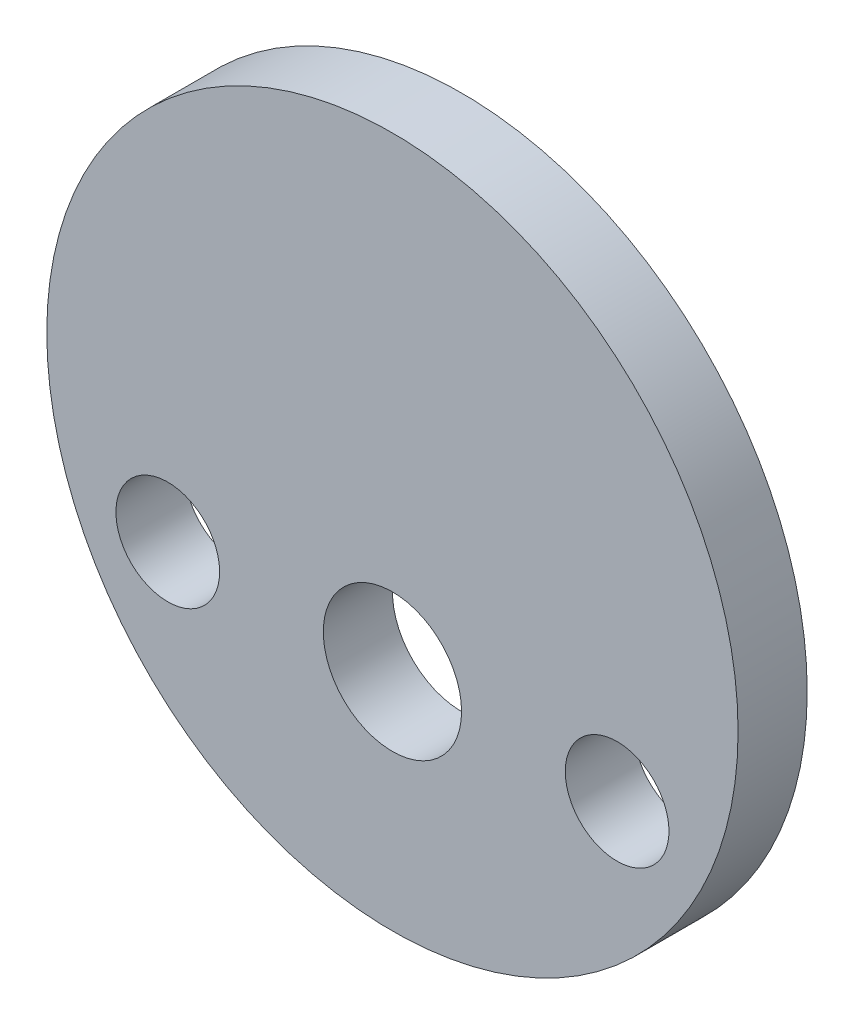
from build123d import *

# Parameters (mm, degrees)
SKETCH_1_R      = 10
SKETCH_1_R_2    = 1.5
SKETCH_1_R_3    = 2
EXTRUDE_1_DEPTH = 2


with BuildPart() as part:
    # 草图1 → 凸台-拉伸1 (new body)
    with BuildSketch(Plane.XY):
        with Locations((-0.589945763, 5.342825614)):
            Circle(SKETCH_1_R)
        with Locations((-7.089945763, 1.842825614)):
            Circle(SKETCH_1_R_2, mode=Mode.SUBTRACT)
        with Locations(Location((5.910054237, 1.842825614, 0), (0, 0, 180))):
            Circle(SKETCH_1_R_2, mode=Mode.SUBTRACT)
        with Locations((-0.589945763, 1.842825614)):
            Circle(SKETCH_1_R_3, mode=Mode.SUBTRACT)
    extrude(amount=EXTRUDE_1_DEPTH)


solid = part.part
